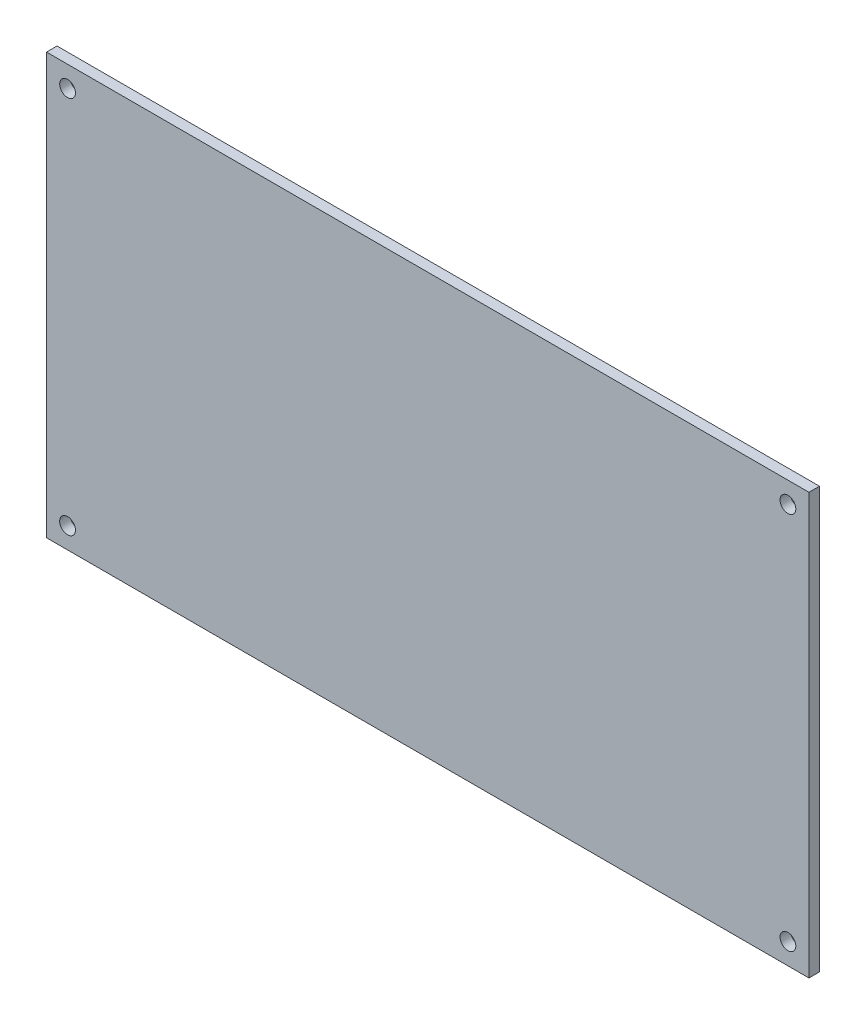
from build123d import *

# Parameters (mm, degrees)
SKETCH_1_W                  = 145
SKETCH_1_H                  = 80
EXTRUDE_1_DEPTH             = 2
SKETCH_2_R                  = 1.5
CUT_EXTRUDE_1_DEPTH         = 2
PATTERN_LINEAR_1_COUNT      = 2
PATTERN_LINEAR_1_PITCH      = 137
PATTERN_LINEAR_1_COUNT_DIR2 = 2
PATTERN_LINEAR_1_PITCH_DIR2 = 72


with BuildPart() as part:
    # Эскиз1 → Бобышка-Вытянуть1 (new body)
    with BuildSketch(Plane.XY):
        with Locations((72.5, 40)):
            Rectangle(SKETCH_1_W, SKETCH_1_H)
    extrude(amount=EXTRUDE_1_DEPTH)

    # Эскиз2 → Вырез-Вытянуть1 (cut)
    with BuildSketch(Plane.XY.offset(2)):
        with Locations((4, 76)):
            Circle(SKETCH_2_R)
    cut_extrude_1 = extrude(amount=-CUT_EXTRUDE_1_DEPTH, mode=Mode.SUBTRACT)

    # Линейный массив1: Cut-Extrude 1 2 × 2
    with Locations(*[(i * PATTERN_LINEAR_1_PITCH, -j * PATTERN_LINEAR_1_PITCH_DIR2, 0) for i in range(PATTERN_LINEAR_1_COUNT) for j in range(PATTERN_LINEAR_1_COUNT_DIR2) if (i, j) != (0, 0)]):
        add(cut_extrude_1, mode=Mode.SUBTRACT)


solid = part.part
